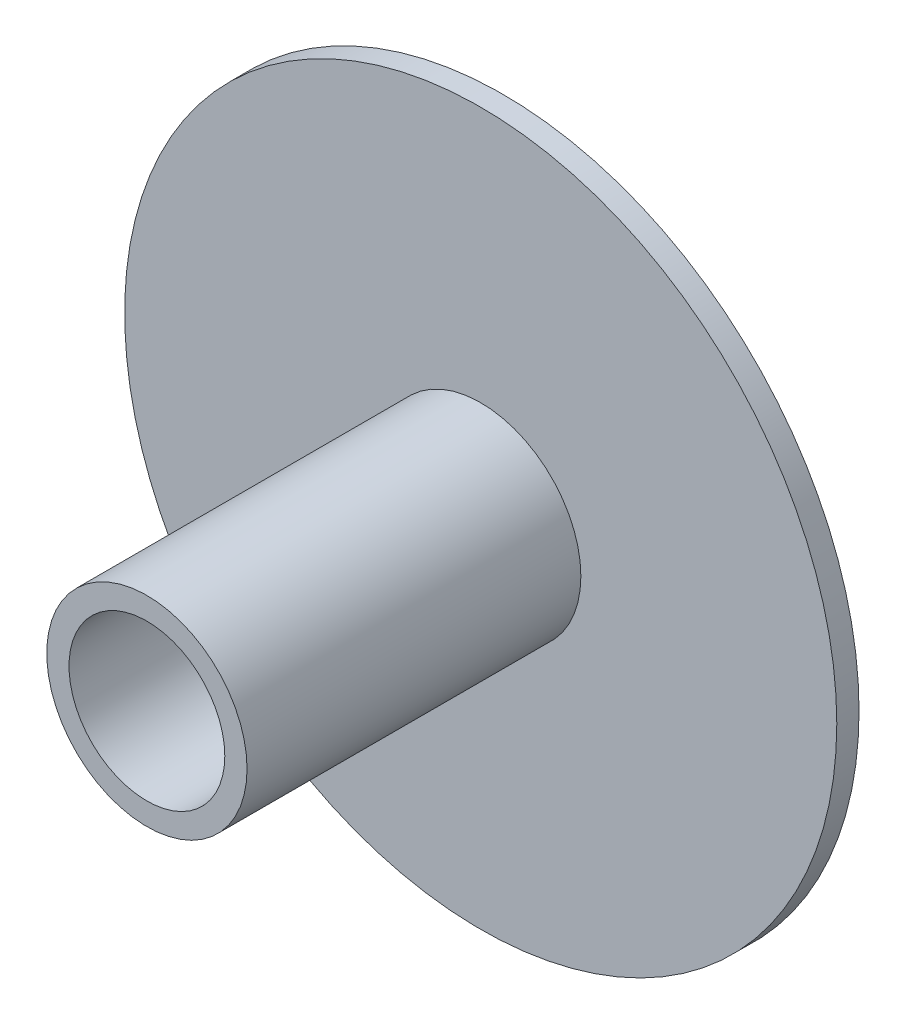
from build123d import *

# Parameters (mm, degrees)
SKETCH1_R               = 16
BOSS_EXTRUDE1_DEPTH     = 1
SKETCH2_R               = 4.5
BOSS_EXTRUDE2_DEPTH     = 15
CUT_EXTRUDE1_DEPTH      = 28.712812921
CUT_EXTRUDE1_DEPTH_BACK = 28.712812921
SKETCH3_R               = 3.5


with BuildPart() as part:
    # Sketch1 → Boss-Extrude1 (new body)
    with BuildSketch(Plane.XY):
        Circle(SKETCH1_R)
    extrude(amount=BOSS_EXTRUDE1_DEPTH)

    # Sketch2 → Boss-Extrude2 (add)
    with BuildSketch(Plane.XY.offset(1)):
        Circle(SKETCH2_R)
    extrude(amount=BOSS_EXTRUDE2_DEPTH)

    # Sketch3 → Cut-Extrude1 (cut, two sides: drawn at the far end of the back side and taken through both)
    with BuildSketch(Plane.XY.offset(16).offset(-CUT_EXTRUDE1_DEPTH_BACK)):
        Circle(SKETCH3_R)
    extrude(amount=CUT_EXTRUDE1_DEPTH + CUT_EXTRUDE1_DEPTH_BACK, mode=Mode.SUBTRACT)


solid = part.part
